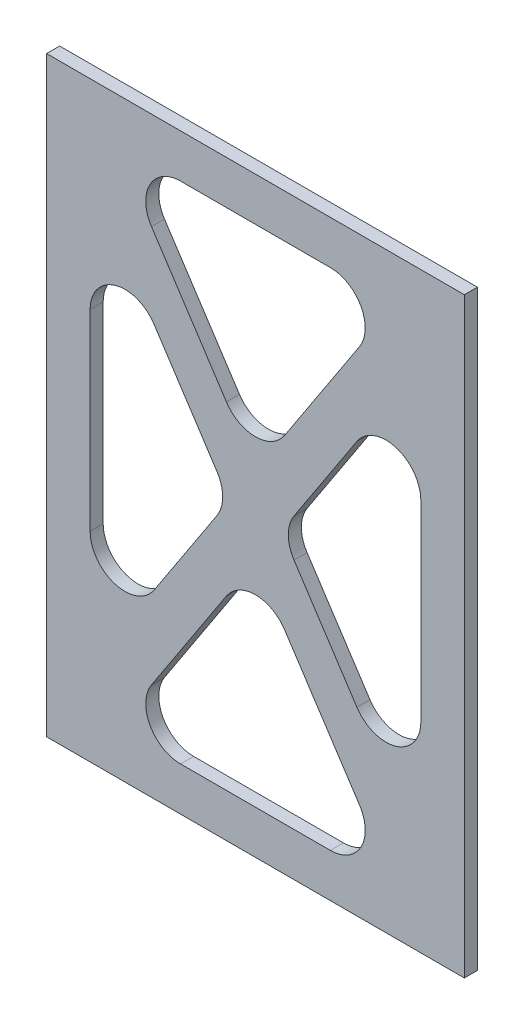
from build123d import *

# Parameters (mm, degrees)
ESBO_O1_W                = 96
ESBO_O1_H                = 136
RESSALTO_EXTRUS_O1_DEPTH = 3
CORTE_EXTRUS_O1_DEPTH    = 10
FILETE1_R                = 8


with BuildPart() as part:
    # Esboço1 → Ressalto-extrusão1 (new body)
    with BuildSketch(Plane.XY):
        Rectangle(ESBO_O1_W, ESBO_O1_H)
    extrude(amount=RESSALTO_EXTRUS_O1_DEPTH)

    # Esboço2 → Corte-extrusão1 (cut)
    with BuildSketch(Plane.XY.offset(3)):
        Polygon((-38, -48.876349567), (-5.977564077, 0), (-38, 48.876349567), align=None)
        Polygon((0, 9.123650433), (32.022435923, 58), (-32.022435923, 58), align=None)
        Polygon((38, -48.876349567), (38, 48.876349567), (5.977564077, 0), align=None)
        Polygon((32.022435923, -58), (0, -9.123650433), (-32.022435923, -58), align=None)
    extrude(amount=-CORTE_EXTRUS_O1_DEPTH, mode=Mode.SUBTRACT)

    # Filete1
    filete1_edges = [part.edges().sort_by_distance(p)[0] for p in [
        (38, 48.876349567, 1.5),
        (38, -48.876349567, 1.5),
        (5.977564077, 0, 1.5),
        (-32.022435923, 58, 1.5),
        (32.022435923, 58, 1.5),
        (0, 9.123650433, 1.5),
        (0, -9.123650433, 1.5),
        (32.022435923, -58, 1.5),
        (-32.022435923, -58, 1.5),
        (-38, 48.876349567, 1.5),
        (-5.977564077, 0, 1.5),
        (-38, -48.876349567, 1.5),
    ]]
    fillet(filete1_edges, radius=FILETE1_R)


solid = part.part
